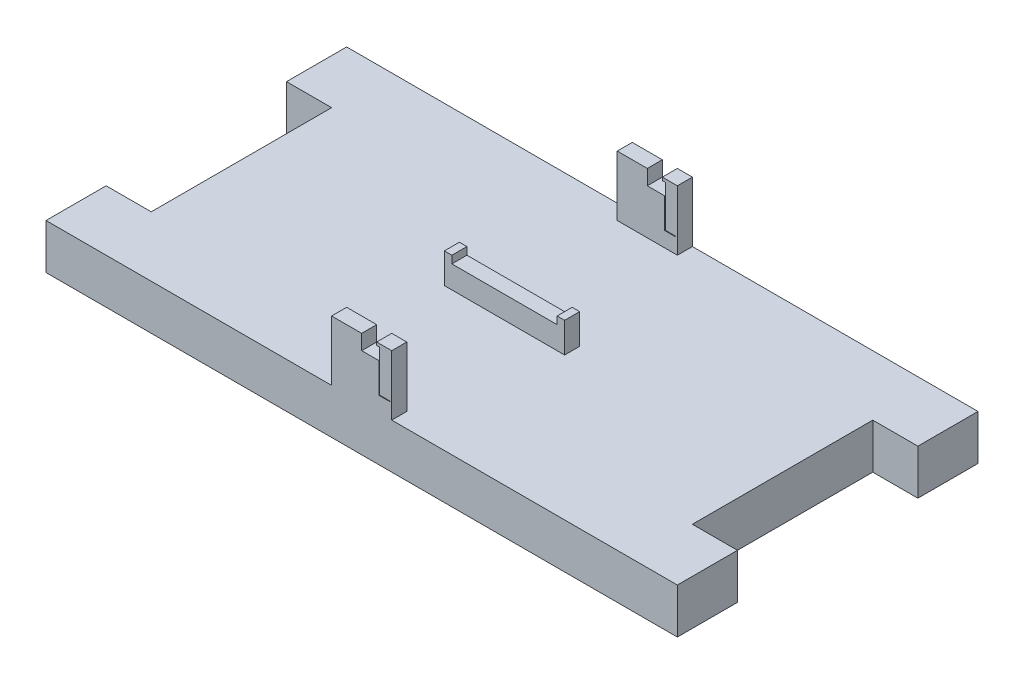
from build123d import *

# Parameters (mm, degrees)
SKETCH1_W           = 266.7
SKETCH1_H           = 127
BOSS_EXTRUDE1_DEPTH = 19.05
SKETCH2_W           = 19.05
SKETCH2_H           = 76.2
CUT_EXTRUDE1_DEPTH  = 149.920700374
SKETCH3_W           = 25.4
SKETCH3_H           = 6.35
BOSS_EXTRUDE2_DEPTH = 25.4
SKETCH5_W           = 6.35
SKETCH5_H           = 6.35
CUT_EXTRUDE2_DEPTH  = 190.438710405
SKETCH6_W           = 1.27
SKETCH6_H           = 5.08
CUT_EXTRUDE3_DEPTH  = 190.438710405
SKETCH7_W           = 0.254
SKETCH7_H           = 12.446
SKETCH7_W_2         = 4.318
SKETCH7_H_2         = 0.254
CUT_EXTRUDE4_DEPTH  = 190.438710405
SKETCH8_W           = 50.8
SKETCH8_H           = 6.35
BOSS_EXTRUDE3_DEPTH = 12.7
CUT_EXTRUDE5_REACH  = 157.575
SKETCH9_W           = 44.45
SKETCH9_H           = 6.35


with BuildPart() as part:
    # Sketch1 → Boss-Extrude1 (new body)
    with BuildSketch(Plane(origin=(0, 0, 0), x_dir=(1, 0, 0), z_dir=(0, 1, 0))):
        Rectangle(SKETCH1_W, SKETCH1_H)
    extrude(amount=BOSS_EXTRUDE1_DEPTH)

    # Sketch2 → Cut-Extrude1 (cut, through all)
    with BuildSketch(Plane(origin=(0, 19.05, 0), x_dir=(1, 0, 0), z_dir=(0, 1, 0))):
        with Locations((-123.825, 0)):
            Rectangle(SKETCH2_W, SKETCH2_H)
    cut_extrude1 = extrude(amount=-CUT_EXTRUDE1_DEPTH, mode=Mode.SUBTRACT)

    # Mirror1: Cut-Extrude1 across plane
    add(cut_extrude1.mirror(Plane(origin=(0, 0, 0), x_dir=(0, 0, 1), z_dir=(1, 0, 0))), mode=Mode.SUBTRACT)

    # Sketch3 → Boss-Extrude2 (add)
    with BuildSketch(Plane(origin=(0, 19.05, 0), x_dir=(1, 0, 0), z_dir=(0, 1, 0))):
        with Locations((0, -60.325)):
            Rectangle(SKETCH3_W, SKETCH3_H)
    boss_extrude2 = extrude(amount=BOSS_EXTRUDE2_DEPTH)

    # Sketch5 → Cut-Extrude2 (cut, through all)
    with BuildSketch(Plane.XY.offset(63.5)):
        with Locations((3.175, 41.275)):
            Rectangle(SKETCH5_W, SKETCH5_H)
    cut_extrude2 = extrude(amount=-CUT_EXTRUDE2_DEPTH, mode=Mode.SUBTRACT)

    # Sketch6 → Cut-Extrude3 (cut, through all)
    with BuildSketch(Plane.XY.offset(63.5)):
        with Locations((6.985, 40.64)):
            Rectangle(SKETCH6_W, SKETCH6_H)
    cut_extrude3 = extrude(amount=-CUT_EXTRUDE3_DEPTH, mode=Mode.SUBTRACT)

    # Sketch7 → Cut-Extrude4 (cut, through all)
    with BuildSketch(Plane.XY.offset(63.5)):
        with Locations((7.493, 31.877)):
            Rectangle(SKETCH7_W, SKETCH7_H)
        with Locations((9.779, 25.527)):
            Rectangle(SKETCH7_W_2, SKETCH7_H_2)
        with Locations((7.493, 25.527)):
            Rectangle(SKETCH7_W, SKETCH7_H_2)
    cut_extrude4 = extrude(amount=-CUT_EXTRUDE4_DEPTH, mode=Mode.SUBTRACT)

    # Mirror2: Boss-Extrude2, Cut-Extrude2, Cut-Extrude3, Cut-Extrude4 across plane
    add(boss_extrude2.mirror(Plane.XY))
    add(cut_extrude2.mirror(Plane.XY), mode=Mode.SUBTRACT)
    add(cut_extrude3.mirror(Plane.XY), mode=Mode.SUBTRACT)
    add(cut_extrude4.mirror(Plane.XY), mode=Mode.SUBTRACT)

    # Sketch8 → Boss-Extrude3 (add)
    with BuildSketch(Plane(origin=(0, 19.05, 0), x_dir=(1, 0, 0), z_dir=(0, 1, 0))):
        Rectangle(SKETCH8_W, SKETCH8_H)
    extrude(amount=BOSS_EXTRUDE3_DEPTH)

    # Sketch9 → Cut-Extrude5 (cut, up to next)
    with BuildSketch(Plane.XY.offset(3.175), mode=Mode.PRIVATE) as cut_extrude5_sk1:
        with Locations((0, 31.75)):
            Rectangle(SKETCH9_W, SKETCH9_H)
    cut_extrude5_tool1 = extrude(cut_extrude5_sk1.sketch, amount=-CUT_EXTRUDE5_REACH, mode=Mode.PRIVATE) & part.part
    add(cut_extrude5_tool1.solids().sort_by_distance((0, 31.75, 3.175))[0], mode=Mode.SUBTRACT)


solid = part.part
